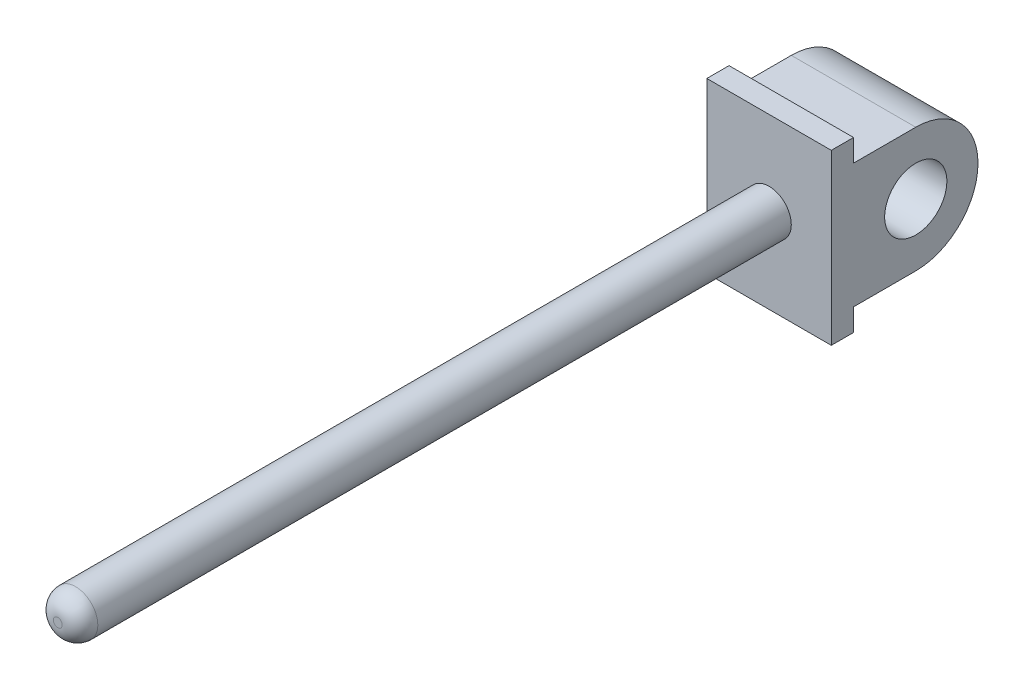
from build123d import *

# Parameters (mm, degrees)
BOSS_EXTRUDE2_DEPTH = 70
SKETCH2_R           = 17.5
CUT_EXTRUDE1_DEPTH  = 70
SKETCH5_R           = 12.5
BOSS_EXTRUDE3_DEPTH = 400
FILLET3_R           = 10


with BuildPart() as part:
    # Sketch1 → Boss-Extrude2 (new body)
    with BuildSketch(Plane(origin=(0, 0, 0), x_dir=(0, 0, -1), z_dir=(1, 0, 0))):
        with BuildLine():
            Line((315, 35), (315, 47.5))
            Line((315, 47.5), (302.5, 47.5))
            Line((302.5, 47.5), (302.5, -47.5))
            Line((302.5, -47.5), (315, -47.5))
            Line((315, -47.5), (315, -35))
            Line((315, -35), (350, -35))
            ThreePointArc((350, -35), (385, 0), (350, 35))
            Line((350, 35), (315, 35))
        make_face()
    extrude(amount=BOSS_EXTRUDE2_DEPTH)

    # Sketch2 → Cut-Extrude1 (cut)
    with BuildSketch(Plane(origin=(70, 0, 0), x_dir=(0, 0, -1), z_dir=(1, 0, 0))):
        with Locations((350, 0)):
            Circle(SKETCH2_R)
    extrude(amount=-CUT_EXTRUDE1_DEPTH, mode=Mode.SUBTRACT)

    # Sketch5 → Boss-Extrude3 (add)
    with BuildSketch(Plane.XY.offset(-302.5)):
        with Locations((35, 0)):
            Circle(SKETCH5_R)
    extrude(amount=BOSS_EXTRUDE3_DEPTH)

    # Fillet3
    fillet3_edges = [part.edges().sort_by_distance(p)[0] for p in [
        (22.5, 0, 97.5),
    ]]
    fillet(fillet3_edges, radius=FILLET3_R)


solid = part.part
